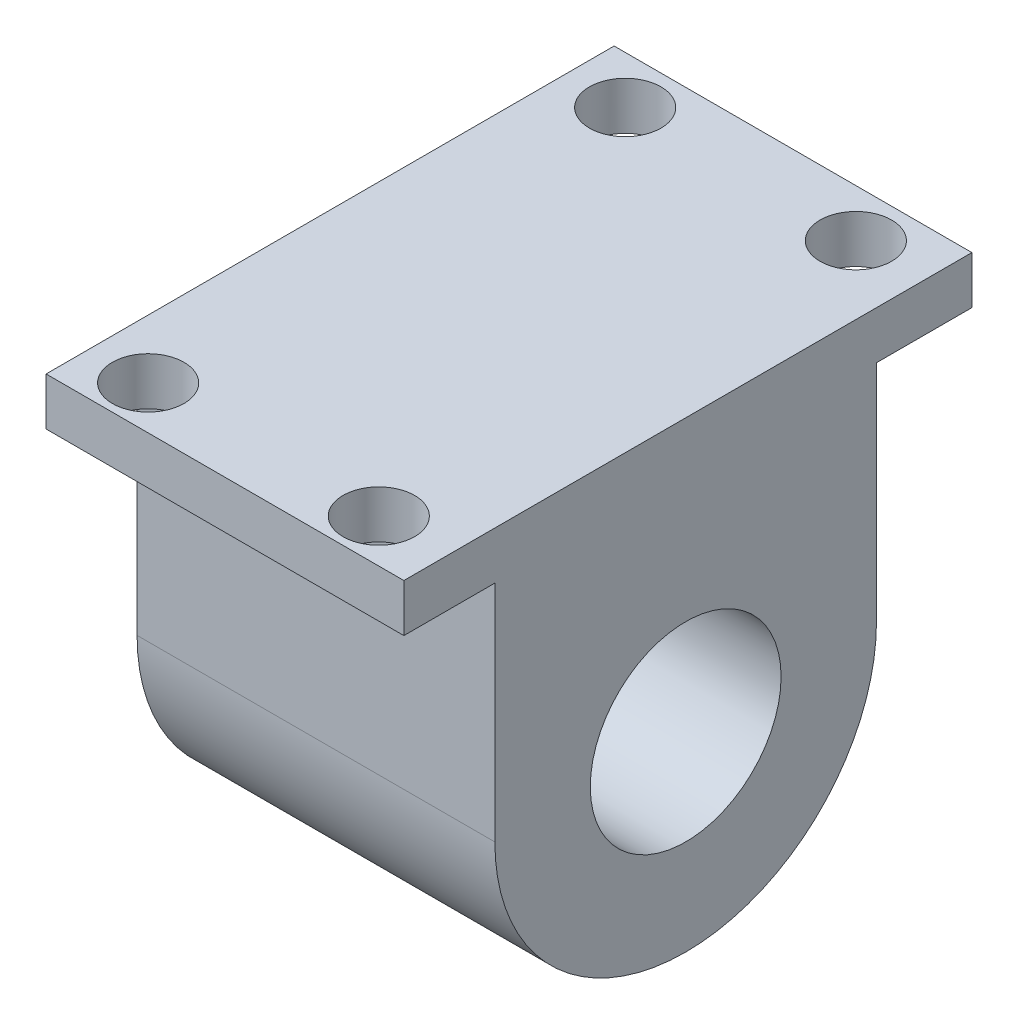
from build123d import *

# Parameters (mm, degrees)
BOSS_EXTRUDE1_DEPTH = 15
SKETCH3_R           = 1.5
CUT_EXTRUDE1_DEPTH  = 15


with BuildPart() as part:
    # Sketch2 → Boss-Extrude1 (new body)
    with BuildSketch(Plane(origin=(0, 0, 0), x_dir=(0, 0, -1), z_dir=(1, 0, 0))):
        with BuildLine():
            Line((8, 11.4), (-7.814981045, 11.4))
            Line((-7.814981045, 11.4), (-11.814981045, 11.4))
            Line((-11.814981045, 11.4), (-11.814981045, 9.4))
            Line((-11.814981045, 9.4), (-8, 9.4))
            Line((-8, 9.4), (-8, 0))
            ThreePointArc((-8, 0), (0, -8), (8, 0))
            Line((8, 0), (8, 9.4))
            Line((8, 9.4), (12, 9.4))
            Line((12, 9.4), (12, 11.4))
            Line((12, 11.4), (8, 11.4))
        make_face()
        with BuildLine():
            ThreePointArc((4, 0), (0, -4), (-4, 0))
            ThreePointArc((-4, 0), (0, 4), (4, 0))
        make_face(mode=Mode.SUBTRACT)
    extrude(amount=BOSS_EXTRUDE1_DEPTH)

    # Sketch3 → Cut-Extrude1 (cut)
    with BuildSketch(Plane.XZ.offset(-9.4)):
        with Locations(Location((2.464362638, -10, 0), (0, 0, 270))):
            Circle(SKETCH3_R)
        with Locations(Location((12.134124748, -10, 0), (0, 0, 270))):
            Circle(SKETCH3_R)
    cut_extrude1 = extrude(amount=-CUT_EXTRUDE1_DEPTH, mode=Mode.SUBTRACT)

    # Mirror1: Cut-Extrude1 across plane
    add(cut_extrude1.mirror(Plane.XY), mode=Mode.SUBTRACT)


solid = part.part
